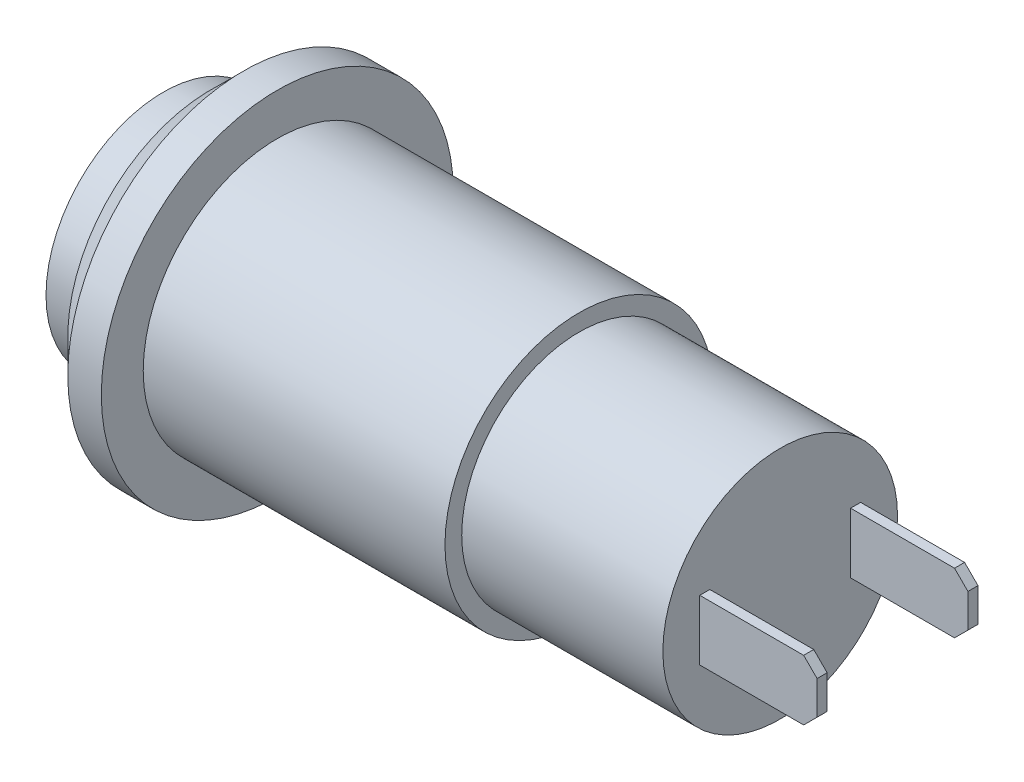
from build123d import *

# Parameters (mm, degrees)
CHAMFER_1_SIZE  = 1
SKETCH_2_W      = 0.3
SKETCH_2_H      = 1.8
EXTRUDE_1_DEPTH = 3.5
CHAMFER_2_SIZE  = 0.4


with BuildPart() as part:
    # 草图1 → 旋转1 (revolve)
    with BuildSketch(Plane.XY, mode=Mode.PRIVATE) as revolve_1_sk:
        Polygon((0, 0), (0, 3.5), (1.4, 3.5), (1.4, 5.25), (3.4, 5.25), (3.4, 4), (12.4, 4), (12.4, 3.5), (18.4, 3.5), (18.4, 0), align=None)
    revolve(revolve_1_sk.sketch.rotate(Axis((-10.984615385, 0, 0), (1, 0, 0)), 90), axis=Axis((-10.984615385, 0, 0), (1, 0, 0)))

    # 倒角1
    chamfer_1_edges = [part.edges().sort_by_distance(p)[0] for p in [
        (1.4, 0, -5.25),
    ]]
    chamfer(chamfer_1_edges, length=CHAMFER_1_SIZE)

    # 草图2 → 凸台-拉伸1 (add)
    with BuildSketch(Plane(origin=(18.4, 0, 0), x_dir=(0, 0, -1), z_dir=(1, 0, 0))):
        with Locations((-2.25, 0)):
            Rectangle(SKETCH_2_W, SKETCH_2_H)
        with Locations((2.25, 0)):
            Rectangle(SKETCH_2_W, SKETCH_2_H)
    extrude(amount=EXTRUDE_1_DEPTH)

    # 倒角2
    chamfer_2_edges = [part.edges().sort_by_distance(p)[0] for p in [
        (21.9, -0.9, 2.25),
        (21.9, 0.9, 2.25),
        (21.9, -0.9, -2.25),
        (21.9, 0.9, -2.25),
    ]]
    chamfer(chamfer_2_edges, length=CHAMFER_2_SIZE)


solid = part.part
